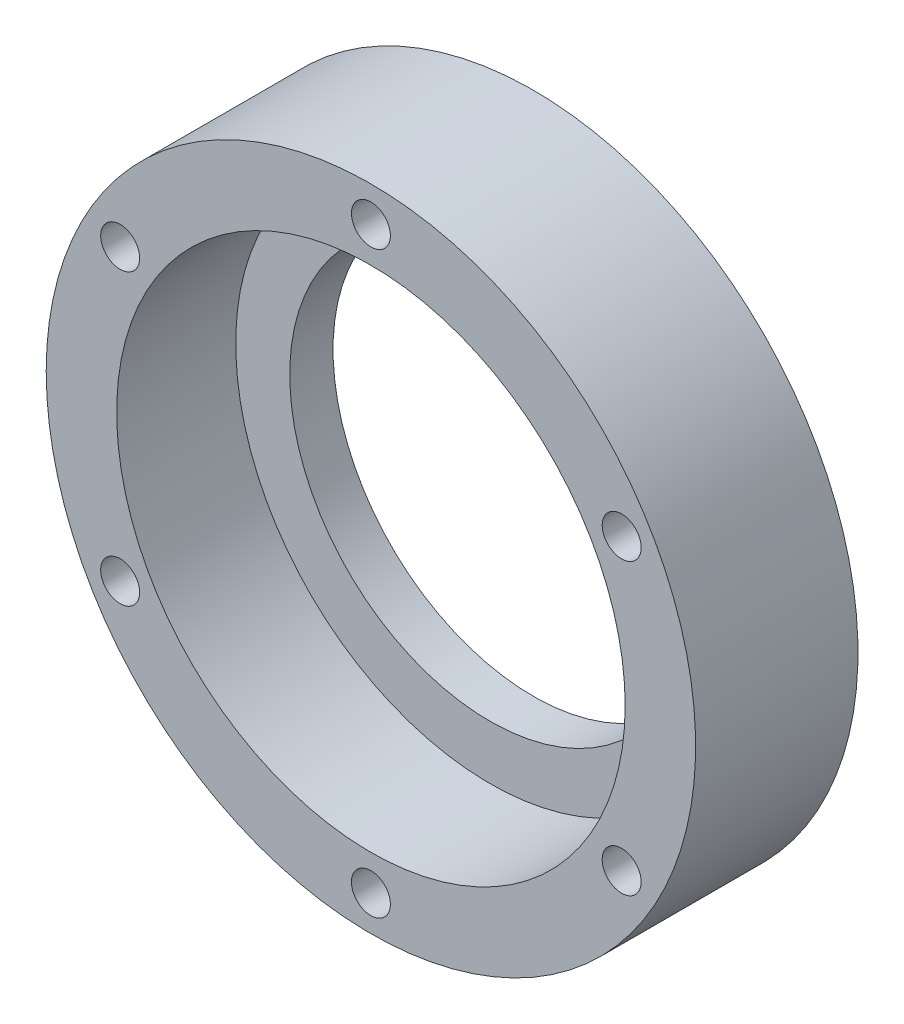
from build123d import *

# Parameters (mm, degrees)
SKETCH1_W                                       = 30
SKETCH1_H                                       = 15
CSK_FOR_M3_FLAT_HEAD_MACHINE_SCREW1_D           = 3.6
CSK_FOR_M3_FLAT_HEAD_MACHINE_SCREW1_CSINK_D     = 6.3
CSK_FOR_M3_FLAT_HEAD_MACHINE_SCREW1_CSINK_ANGLE = 90
HOLE1_D                                         = 37
HOLE1_CBORE_D                                   = 46.98238
HOLE1_CBORE_DEPTH                               = 11


with BuildPart() as part:
    # Sketch1 → Revolve1 (revolve)
    with BuildSketch(Plane.XZ, mode=Mode.PRIVATE) as revolve1_sk:
        with Locations((15, 7.5)):
            Rectangle(SKETCH1_W, SKETCH1_H)
    revolve(revolve1_sk.sketch.rotate(Axis((0, 0, 15), (0, 0, -1)), 180), axis=Axis((0, 0, 15), (0, 0, -1)))

    # CSK for M3 Flat Head Machine Screw1 (through all)
    with Locations(Plane(origin=(0, 0, 0), x_dir=(-1, 0, 0), z_dir=(0, 0, -1))):
        with Locations((23.166179551, -13.375), (23.166179551, 13.375), (0, -26.75), (-23.166179551, 13.375), (-23.166179551, -13.375), (0, 26.75)):
            CounterSinkHole(CSK_FOR_M3_FLAT_HEAD_MACHINE_SCREW1_D / 2, CSK_FOR_M3_FLAT_HEAD_MACHINE_SCREW1_CSINK_D / 2, counter_sink_angle=CSK_FOR_M3_FLAT_HEAD_MACHINE_SCREW1_CSINK_ANGLE)

    # Hole1 (through all)
    with Locations(Plane.XY.offset(15)):
        with Locations((0, 0)):
            CounterBoreHole(HOLE1_D / 2, HOLE1_CBORE_D / 2, HOLE1_CBORE_DEPTH)


solid = part.part
